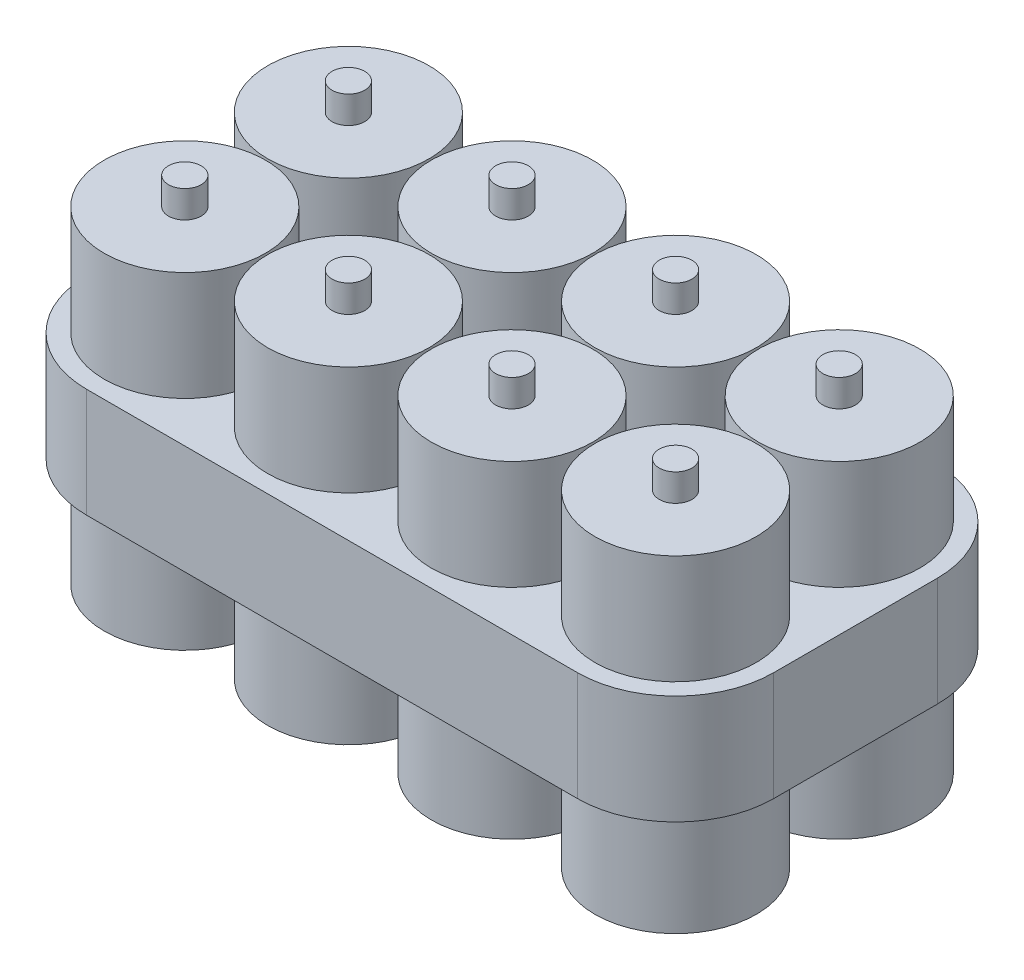
from build123d import *

# Parameters (mm, degrees)
EXTRUDE_8_DEPTH = 20
SKETCH_1_R      = 14.8
EXTRUDE_1_DEPTH = 60
SKETCH_2_R      = 3
EXTRUDE_2_DEPTH = 5


with BuildPart() as part:
    # 草图3 → 凸台-拉伸8 (new body)
    with BuildSketch(Plane(origin=(0, 20, 0), x_dir=(1, 0, 0), z_dir=(0, 1, 0))):
        with BuildLine():
            Line((0, 48), (90, 48))
            ThreePointArc((90, 48), (102.727922061, 42.727922061), (108, 30))
            Line((108, 30), (108, 0))
            ThreePointArc((108, 0), (102.727922061, -12.727922061), (90, -18))
            Line((90, -18), (0, -18))
            ThreePointArc((0, -18), (-12.727922061, -12.727922061), (-18, 0))
            Line((-18, 0), (-18, 30))
            ThreePointArc((-18, 30), (-12.727922061, 42.727922061), (0, 48))
        make_face()
    extrude(amount=EXTRUDE_8_DEPTH)

    # 草图1 → 凸台-拉伸1 (add)
    with BuildSketch(Plane(origin=(0, 0, 0), x_dir=(1, 0, 0), z_dir=(0, 1, 0))):
        with Locations(Location((0, 30, 0), (0, 0, 270))):
            Circle(SKETCH_1_R)
        with Locations(Location((30, 30, 0), (0, 0, 270))):
            Circle(SKETCH_1_R)
        with Locations(Location((60, 30, 0), (0, 0, 270))):
            Circle(SKETCH_1_R)
        with Locations(Location((90, 30, 0), (0, 0, 270))):
            Circle(SKETCH_1_R)
        with Locations(Location((90, 0, 0), (0, 0, 270))):
            Circle(SKETCH_1_R)
        with Locations(Location((60, 0, 0), (0, 0, 270))):
            Circle(SKETCH_1_R)
        with Locations(Location((30, 0, 0), (0, 0, 270))):
            Circle(SKETCH_1_R)
        with Locations(Location((0, 0, 0), (0, 0, 270))):
            Circle(SKETCH_1_R)
    extrude(amount=EXTRUDE_1_DEPTH)

    # 草图2 → 凸台-拉伸2 (add)
    with BuildSketch(Plane(origin=(0, 60, 0), x_dir=(1, 0, 0), z_dir=(0, 1, 0))):
        with Locations(Location((0, 30, 0), (0, 0, 270))):
            Circle(SKETCH_2_R)
        with Locations(Location((30, 30, 0), (0, 0, 270))):
            Circle(SKETCH_2_R)
        with Locations(Location((60, 30, 0), (0, 0, 270))):
            Circle(SKETCH_2_R)
        with Locations(Location((90, 30, 0), (0, 0, 270))):
            Circle(SKETCH_2_R)
        with Locations(Location((30, 0, 0), (0, 0, 270))):
            Circle(SKETCH_2_R)
        with Locations(Location((60, 0, 0), (0, 0, 270))):
            Circle(SKETCH_2_R)
        with Locations(Location((90, 0, 0), (0, 0, 270))):
            Circle(SKETCH_2_R)
        with Locations(Location((0, 0, 0), (0, 0, 270))):
            Circle(SKETCH_2_R)
    extrude(amount=EXTRUDE_2_DEPTH)


solid = part.part
